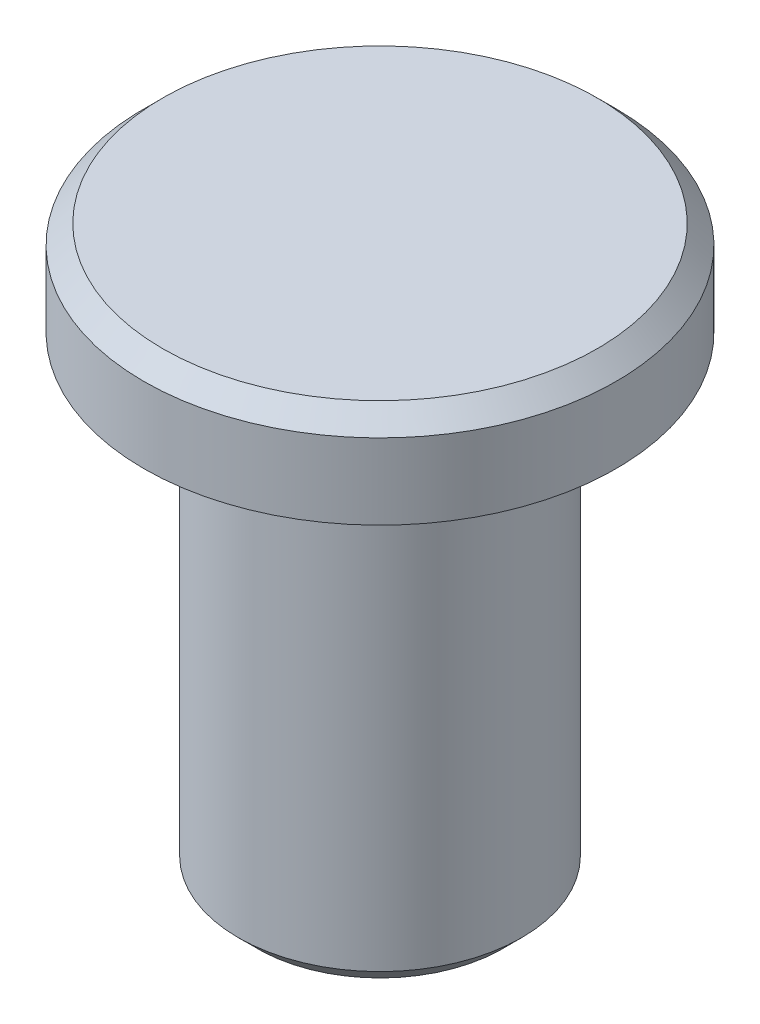
from build123d import *

# Parameters (mm, degrees)
CHAMFER1_SIZE = 0.2


with BuildPart() as part:
    # Sketch2 → Revolve3 (revolve)
    with BuildSketch(Plane.XY, mode=Mode.PRIVATE) as revolve3_sk:
        Polygon((0, 0), (0, 6), (2.5, 6), (2.5, 5), (1.5, 5), (1.5, 0), align=None)
    revolve(revolve3_sk.sketch.rotate(Axis((0, 0, 0), (0, 1, 0)), 90), axis=Axis((0, 0, 0), (0, 1, 0)))

    # Chamfer1
    chamfer1_edges = [part.edges().sort_by_distance(p)[0] for p in [
        (0, 0, 1.5),
        (0, 6, 2.5),
    ]]
    chamfer(chamfer1_edges, length=CHAMFER1_SIZE)


solid = part.part
